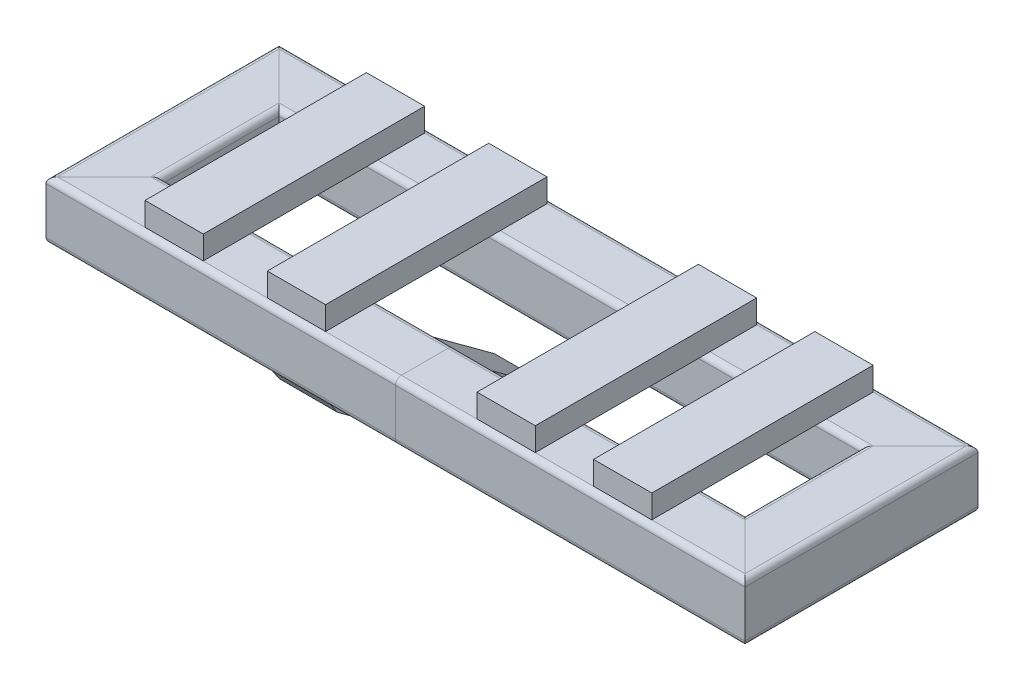
from build123d import *

# Parameters (mm, degrees)
SKETCH5_W           = 50.00000000000001
SKETCH5_H           = 50
SKETCH10_W          = 846.4866201904617
SKETCH10_H          = 361.1409219051918
CUT_EXTRUDE1_DEPTH  = 402.55848422828825
SKETCH12_W          = 1370.912564730276
SKETCH12_H          = 1025.6443891593005
CUT_EXTRUDE2_DEPTH  = 435.26163944528145
BOSS_EXTRUDE1_DEPTH = 20


with BuildPart() as part:
    # Sweep1: sweep along a path in Sketch1
    with BuildLine(Plane(origin=(0, 0, 0), x_dir=(1, 0, 0), z_dir=(0, 1, 0))) as sweep1_path:
        Line((-299.99999999999994, -99.99999999999997), (300.00000000000006, -99.99999999999997))
        Line((300.00000000000006, -99.99999999999997), (300.00000000000006, 100.00000000000003))
        Line((300.00000000000006, 100.00000000000003), (-299.99999999999994, 100.00000000000003))
        Line((-299.99999999999994, 100.00000000000003), (-299.99999999999994, -99.99999999999997))
    # Sketch2 → Sweep1 (sweep)
    with BuildSketch(Plane(origin=(0, 0, 0), x_dir=(0, 0, -1), z_dir=(1, 0, 0))):
        with BuildLine():
            Line((-94.99999999999994, 0), (-55.00000000000001, 0))
            ThreePointArc((-55.00000000000001, 0), (-51.464466094067234, -1.4644660940672622), (-49.99999999999997, -5.000000000000035))
            Line((-49.99999999999997, -5.000000000000035), (-49.99999999999997, -44.99999999999997))
            ThreePointArc((-49.99999999999997, -44.99999999999997), (-51.464466094067234, -48.535533905932745), (-55.00000000000001, -50))
            Line((-55.00000000000001, -50), (-94.99999999999994, -50))
            ThreePointArc((-94.99999999999994, -50), (-98.53553390593271, -48.53553390593274), (-99.99999999999997, -44.99999999999997))
            Line((-99.99999999999997, -44.99999999999997), (-99.99999999999997, -5.0000000000000355))
            ThreePointArc((-99.99999999999997, -5.0000000000000355), (-98.53553390593271, -1.4644660940672654), (-94.99999999999994, 0))
        make_face()
    sweep(path=sweep1_path.line, transition=Transition.RIGHT)

    # Sketch13 → Boss-Extrude1 (add)
    with BuildSketch(Plane(origin=(0, 0, 0), x_dir=(1, 0, 0), z_dir=(0, 1, 0))):
        Polygon((-219.99999999999991, -94.99999999999991), (-169.99999999999994, -94.99999999999991), (-169.99999999999994, 94.99999999999993), (-219.99999999999991, 94.99999999999994), align=None)
        Polygon((-114.99999999999989, -94.99999999999991), (-64.99999999999991, -94.99999999999991), (-64.99999999999989, 94.99999999999993), (-114.9999999999999, 94.99999999999999), align=None)
        Polygon((64.99999999999997, -94.99999999999994), (114.99999999999997, -94.99999999999994), (114.99999999999997, 94.99999999999994), (64.99999999999997, 94.99999999999993), align=None)
        Polygon((164.99999999999997, -94.99999999999994), (214.99999999999997, -94.99999999999994), (214.99999999999997, 94.99999999999993), (164.99999999999997, 94.99999999999994), align=None)
    extrude(amount=BOSS_EXTRUDE1_DEPTH)


with BuildPart() as body_2:
    # Sweep3: sweep along a path in Sketch3
    with BuildLine(Plane.ZY.offset(89.99999999999994)) as sweep3_path:
        Line((69.99999999999999, -44.99999999999994), (-170.5817313387843, -221.8983318667533))
    # Sketch5 → Sweep3 (sweep)
    with BuildSketch(Plane(origin=(-89.99999999999994, -44.999999999999964, 70), x_dir=(-1, 0, 0), z_dir=(0, -0.5923904504775186, -0.8056510126494241))):
        Rectangle(SKETCH5_W, SKETCH5_H)
    sweep(path=sweep3_path.line)

    # Sketch10 → Cut-Extrude1 (cut, through all)
    with BuildSketch(Plane.XZ.offset(50)):
        Rectangle(SKETCH10_W, SKETCH10_H)
    extrude(amount=-CUT_EXTRUDE1_DEPTH, mode=Mode.SUBTRACT)

    # Sketch11 → section 1 of loft1
    with BuildSketch(Plane.XZ.offset(50), mode=Mode.PRIVATE) as loft1_s1:
        with BuildLine():
            Line((-114.99999999999993, 73.67647058823533), (-114.99999999999993, 94.99999999999991))
            Line((-114.99999999999993, 94.99999999999991), (-64.99999999999994, 94.99999999999991))
            Line((-64.99999999999994, 94.99999999999991), (-64.99999999999994, 73.67647058823533))
            Line((-64.99999999999994, 73.67647058823533), (-114.99999999999993, 73.67647058823533))
        make_face()
    # loft from a face of the part (loft1)
    loft([body_2.faces().sort_by_distance((-89.99999999999993, -57.57063765811777, 79.24311592508671))[0], loft1_s1.sketch])

    # Sketch12 → Cut-Extrude2 (cut, through all)
    with BuildSketch(Plane(origin=(0, 0, -100), x_dir=(-1, 0, 0), z_dir=(0, 0, -1))):
        Rectangle(SKETCH12_W, SKETCH12_H)
    extrude(amount=CUT_EXTRUDE2_DEPTH, mode=Mode.SUBTRACT)


solid = Compound([part.part, body_2.part])
